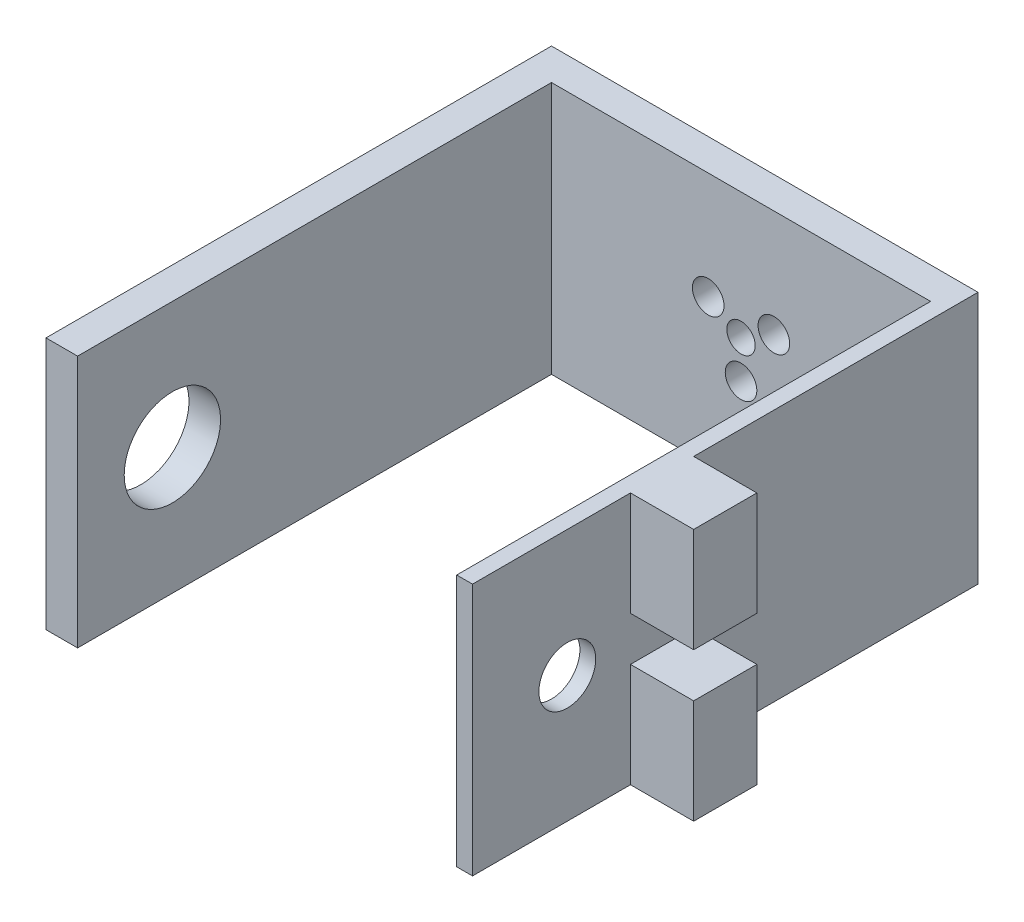
from build123d import *

# Parameters (mm, degrees)
BOSS_EXTRUDE1_DEPTH = 40
SKETCH2_R           = 2.5
CUT_EXTRUDE1_DEPTH  = 97.046863561
CUT_EXTRUDE2_REACH  = 91.123
SKETCH3_R           = 7.625
SKETCH4_R           = 4.5
CUT_EXTRUDE4_DEPTH  = 10
SKETCH4_4_W         = 10
SKETCH4_4_H         = 16.5
BOSS_EXTRUDE2_DEPTH = 10
CUT_EXTRUDE5_REACH  = 101.027
SKETCH2_3_R         = 2.25


with BuildPart() as part:
    # Sketch1 → Boss-Extrude1 (new body)
    with BuildSketch(Plane(origin=(0, 0, 0), x_dir=(1, 0, 0), z_dir=(0, 1, 0))):
        Polygon((-35, -42.269292904), (-30, -42.269292904), (-30, 32.730707096), (30, 32.730707096), (30, -42.269292904), (32.5, -42.269292904), (32.5, 37.730707096), (-35, 37.730707096), align=None)
    extrude(amount=BOSS_EXTRUDE1_DEPTH)

    # Sketch2 → Cut-Extrude1 (cut, through all)
    with BuildSketch(Plane(origin=(0, 0, -37.730707096), x_dir=(-1, 0, 0), z_dir=(0, 0, -1))):
        with Locations((0.002434277, 14.03894843)):
            Circle(SKETCH2_R)
        with Locations((-5.193718146, 23.03894843)):
            Circle(SKETCH2_R)
        with Locations((5.1985867, 23.03894843)):
            Circle(SKETCH2_R)
    extrude(amount=-CUT_EXTRUDE1_DEPTH, mode=Mode.SUBTRACT)

    # Sketch3 → Cut-Extrude2 (cut, up to next)
    with BuildSketch(Plane.ZY.offset(35), mode=Mode.PRIVATE) as cut_extrude2_sk1:
        with Locations((27.269292904, 20)):
            Circle(SKETCH3_R)
    cut_extrude2_tool1 = extrude(cut_extrude2_sk1.sketch, amount=-CUT_EXTRUDE2_REACH, mode=Mode.PRIVATE) & part.part
    add(cut_extrude2_tool1.solids().sort_by_distance((-35, 20, 27.269293))[0], mode=Mode.SUBTRACT)

    # Sketch4 → Cut-Extrude4 (cut)
    with BuildSketch(Plane(origin=(32.5, 0, 0), x_dir=(0, 0, -1), z_dir=(1, 0, 0))):
        with Locations((-27.269292904, 20)):
            Circle(SKETCH4_R)
    extrude(amount=-CUT_EXTRUDE4_DEPTH, mode=Mode.SUBTRACT)

    # Sketch4<4> → Boss-Extrude2 (add)
    with BuildSketch(Plane(origin=(32.5, 0, 0), x_dir=(0, 0, -1), z_dir=(1, 0, 0))):
        with Locations((-12.269292904, 31.75)):
            Rectangle(SKETCH4_4_W, SKETCH4_4_H)
        with Locations((-12.269292904, 8.25)):
            Rectangle(SKETCH4_4_W, SKETCH4_4_H)
    extrude(amount=BOSS_EXTRUDE2_DEPTH)

    # Sketch2<3> → Cut-Extrude5 (cut, up to next)
    with BuildSketch(Plane(origin=(0, 0, -37.730707096), x_dir=(-1, 0, 0), z_dir=(0, 0, -1)), mode=Mode.PRIVATE) as cut_extrude5_sk1:
        with Locations((0.002434277, 20.03894843)):
            Circle(SKETCH2_3_R)
    cut_extrude5_tool1 = extrude(cut_extrude5_sk1.sketch, amount=-CUT_EXTRUDE5_REACH, mode=Mode.PRIVATE) & part.part
    add(cut_extrude5_tool1.solids().sort_by_distance((-0.002434, 20.038948, -37.730707))[0], mode=Mode.SUBTRACT)


solid = part.part
